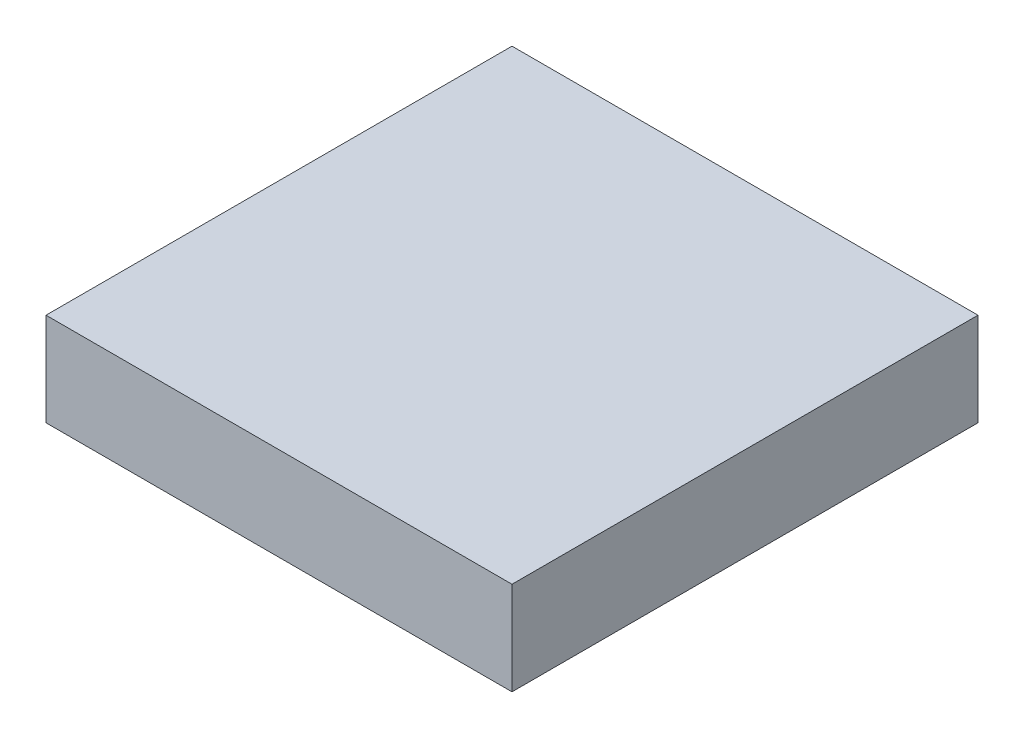
from build123d import *

# Parameters (mm, degrees)
SKETCH1_W           = 12.7
SKETCH1_H           = 12.7
BOSS_EXTRUDE1_DEPTH = 2.54


with BuildPart() as part:
    # Sketch1 → Boss-Extrude1 (new body)
    with BuildSketch(Plane(origin=(0, 0, 0), x_dir=(1, 0, 0), z_dir=(0, 1, 0))):
        Rectangle(SKETCH1_W, SKETCH1_H)
    extrude(amount=BOSS_EXTRUDE1_DEPTH)


solid = part.part
